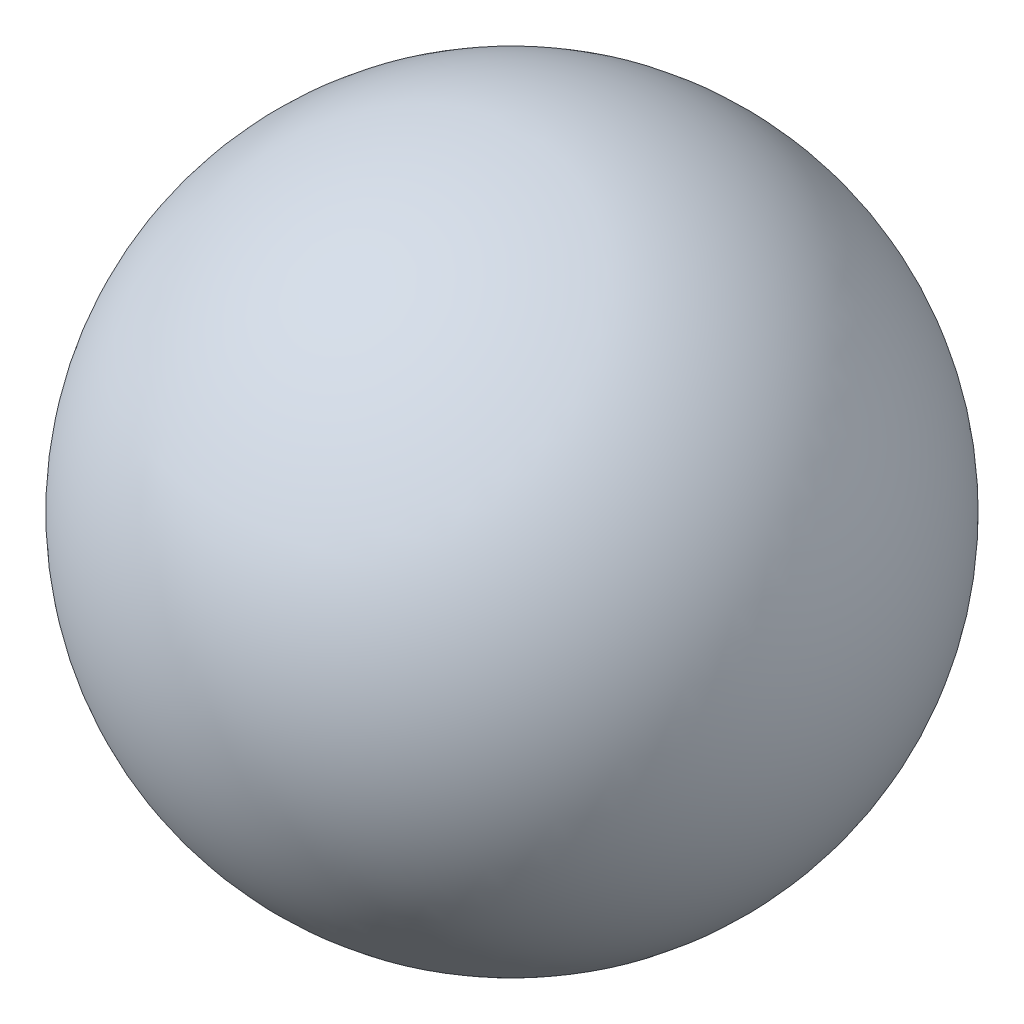
from build123d import *


with BuildPart() as part:
    # Sketch2 → Revolve1 (revolve)
    with BuildSketch(Plane.YZ):
        with BuildLine():
            Line((0, 6.35), (0, 0))
            Line((0, 0), (-6.35, 0))
            ThreePointArc((-6.35, 0), (-4.490128061, 4.490128061), (0, 6.35))
        make_face()
    revolve1 = revolve(axis=Axis((0, 0.3175, 0), (0, -1, 0)))

    # Mirror1: Revolve1 across plane
    add(revolve1.mirror(Plane.ZX))


solid = part.part
